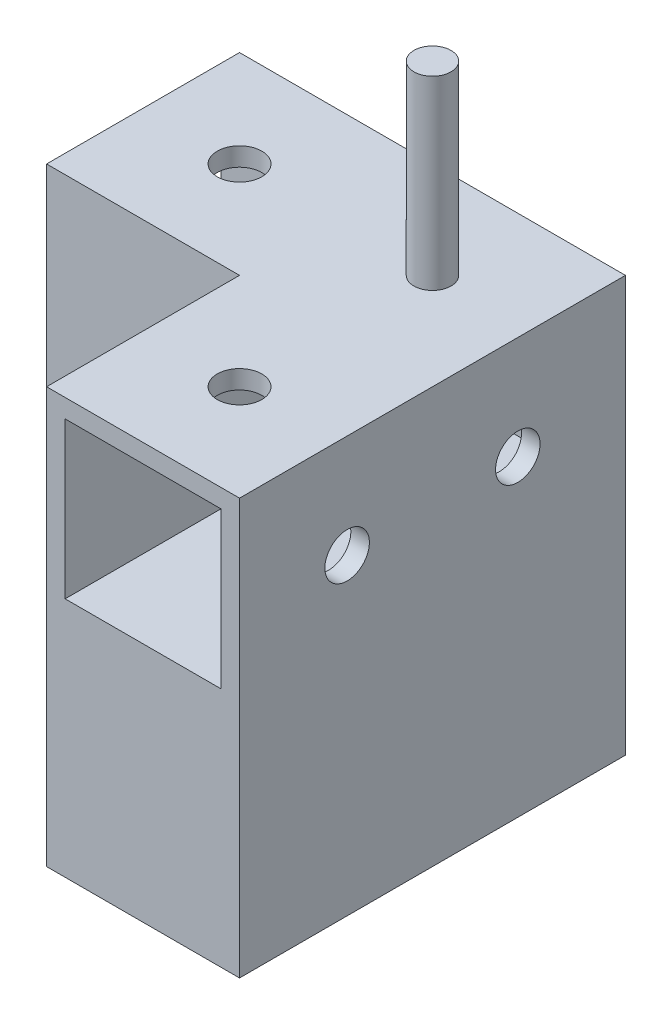
from build123d import *

# Parameters (mm, degrees)
BOSS_EXTRUDE1_DEPTH = 3
SKETCH2_R           = 2.5
BOSS_EXTRUDE2_DEPTH = 25
CUT_EXTRUDE1_REACH  = 46.463
SKETCH5_R           = 3
BOSS_EXTRUDE3_DEPTH = 20
BOSS_EXTRUDE4_DEPTH = 3
SKETCH9_W           = 21
SKETCH9_H           = 21
CUT_EXTRUDE3_DEPTH  = 49
SKETCH10_W          = 21
SKETCH10_H          = 21
CUT_EXTRUDE4_DEPTH  = 49
BOSS_EXTRUDE5_DEPTH = 30
CUT_EXTRUDE5_REACH  = 80.67
SKETCH12_R          = 3
CUT_EXTRUDE6_REACH  = 80.67
SKETCH13_R          = 3
SKETCH14_OUTSIDE_W  = 75.88
SKETCH14_OUTSIDE_H  = 75.88
CUT_EXTRUDE8_DEPTH  = 29


with BuildPart() as part:
    # Sketch1 → Boss-Extrude1 (new body)
    with BuildSketch(Plane(origin=(0, 0, 0), x_dir=(1, 0, 0), z_dir=(0, 1, 0))):
        Polygon((0, -26), (26, -26), (26, 26), (-26, 26), (-26, 0), (0, 0), align=None)
    extrude(amount=BOSS_EXTRUDE1_DEPTH)

    # Sketch2 → Boss-Extrude2 (add)
    with BuildSketch(Plane(origin=(0, 3, 0), x_dir=(1, 0, 0), z_dir=(0, 1, 0))):
        with Locations(Location((13, 13, 0), (0, 0, 90))):
            Circle(SKETCH2_R)
    extrude(amount=BOSS_EXTRUDE2_DEPTH)

    # Sketch5 → Cut-Extrude1 (cut, up to next)
    with BuildSketch(Plane(origin=(0, 3, 0), x_dir=(1, 0, 0), z_dir=(0, 1, 0)), mode=Mode.PRIVATE) as cut_extrude1_sk1:
        with Locations(Location((-13, 13, 0), (0, 0, 270))):
            Circle(SKETCH5_R)
    cut_extrude1_tool1 = extrude(cut_extrude1_sk1.sketch, amount=-CUT_EXTRUDE1_REACH, mode=Mode.PRIVATE) & part.part
    # Sketch5 → Cut-Extrude1 (cut, up to next)
    with BuildSketch(Plane(origin=(0, 3, 0), x_dir=(1, 0, 0), z_dir=(0, 1, 0)), mode=Mode.PRIVATE) as cut_extrude1_sk2:
        with Locations(Location((13, -13, 0), (0, 0, 270))):
            Circle(SKETCH5_R)
    cut_extrude1_tool2 = extrude(cut_extrude1_sk2.sketch, amount=-CUT_EXTRUDE1_REACH, mode=Mode.PRIVATE) & part.part
    add(cut_extrude1_tool1.solids().sort_by_distance((-13, 3, -13))[0], mode=Mode.SUBTRACT)
    add(cut_extrude1_tool2.solids().sort_by_distance((13, 3, 13))[0], mode=Mode.SUBTRACT)

    # Sketch7 → Boss-Extrude3 (add)
    with BuildSketch(Plane.XZ):
        Polygon((26, -26), (26, 26), (0, 26), (0, 0), (-26, 0), (-26, -26), align=None)
        Polygon((23, -23), (23, 23), (3, 23), (3, -3), (-23, -3), (-23, -23), align=None, mode=Mode.SUBTRACT)
    extrude(amount=BOSS_EXTRUDE3_DEPTH)

    # Sketch8 → Boss-Extrude4 (add)
    with BuildSketch(Plane.XZ.offset(20)):
        Polygon((-26, -26), (26, -26), (26, 26), (0, 26), (0, 0), (-26, 0), align=None)
    extrude(amount=BOSS_EXTRUDE4_DEPTH)

    # Sketch9 → Cut-Extrude3 (cut)
    with BuildSketch(Plane.XY.offset(26)):
        with Locations((13, -10)):
            Rectangle(SKETCH9_W, SKETCH9_H)
    extrude(amount=-CUT_EXTRUDE3_DEPTH, mode=Mode.SUBTRACT)

    # Sketch10 → Cut-Extrude4 (cut)
    with BuildSketch(Plane.ZY.offset(26)):
        with Locations((-13, -10)):
            Rectangle(SKETCH10_W, SKETCH10_H)
    extrude(amount=-CUT_EXTRUDE4_DEPTH, mode=Mode.SUBTRACT)

    # Sketch11 → Boss-Extrude5 (add)
    with BuildSketch(Plane.XZ.offset(23)):
        Polygon((-26, 0), (-26, -26), (26, -26), (26, 26), (0, 26), (0, 0), align=None)
    extrude(amount=BOSS_EXTRUDE5_DEPTH)

    # Sketch12 → Cut-Extrude5 (cut, up to next)
    with BuildSketch(Plane(origin=(0, 0, -26), x_dir=(-1, 0, 0), z_dir=(0, 0, -1)), mode=Mode.PRIVATE) as cut_extrude5_sk1:
        with Locations((-13, -10)):
            Circle(SKETCH12_R)
    cut_extrude5_tool1 = extrude(cut_extrude5_sk1.sketch, amount=-CUT_EXTRUDE5_REACH, mode=Mode.PRIVATE) & part.part
    # Sketch12 → Cut-Extrude5 (cut, up to next)
    with BuildSketch(Plane(origin=(0, 0, -26), x_dir=(-1, 0, 0), z_dir=(0, 0, -1)), mode=Mode.PRIVATE) as cut_extrude5_sk2:
        with Locations((13, -10)):
            Circle(SKETCH12_R)
    cut_extrude5_tool2 = extrude(cut_extrude5_sk2.sketch, amount=-CUT_EXTRUDE5_REACH, mode=Mode.PRIVATE) & part.part
    add(cut_extrude5_tool1.solids().sort_by_distance((13, -10, -26))[0], mode=Mode.SUBTRACT)
    add(cut_extrude5_tool2.solids().sort_by_distance((-13, -10, -26))[0], mode=Mode.SUBTRACT)

    # Sketch13 → Cut-Extrude6 (cut, up to next)
    with BuildSketch(Plane(origin=(26, 0, 0), x_dir=(0, 0, -1), z_dir=(1, 0, 0)), mode=Mode.PRIVATE) as cut_extrude6_sk1:
        with Locations((-11.5, -10.917464776)):
            Circle(SKETCH13_R)
    cut_extrude6_tool1 = extrude(cut_extrude6_sk1.sketch, amount=-CUT_EXTRUDE6_REACH, mode=Mode.PRIVATE) & part.part
    # Sketch13 → Cut-Extrude6 (cut, up to next)
    with BuildSketch(Plane(origin=(26, 0, 0), x_dir=(0, 0, -1), z_dir=(1, 0, 0)), mode=Mode.PRIVATE) as cut_extrude6_sk2:
        with Locations((11.5, -10.917464776)):
            Circle(SKETCH13_R)
    cut_extrude6_tool2 = extrude(cut_extrude6_sk2.sketch, amount=-CUT_EXTRUDE6_REACH, mode=Mode.PRIVATE) & part.part
    add(cut_extrude6_tool1.solids().sort_by_distance((26, -10.917465, 11.5))[0], mode=Mode.SUBTRACT)
    add(cut_extrude6_tool2.solids().sort_by_distance((26, -10.917465, -11.5))[0], mode=Mode.SUBTRACT)

    # Sketch14 outside → Cut-Extrude8 (cut)
    # profile 1 of 2: a face of its own
    with BuildSketch(Plane.XZ.offset(53)):
        Rectangle(SKETCH14_OUTSIDE_W, SKETCH14_OUTSIDE_H)
        Polygon((0, 0), (-26, 0), (-26, -26), (26, -26), (26, 26), (0, 26), align=None, mode=Mode.SUBTRACT)
    # profile 2 of 2: a face of its own
    with BuildSketch(Plane.XZ.offset(53)):
        Polygon((5, -5), (-21, -5), (-21, -21), (21, -21), (21, 21), (5, 21), align=None)
    extrude(amount=-CUT_EXTRUDE8_DEPTH, mode=Mode.SUBTRACT)


solid = part.part
